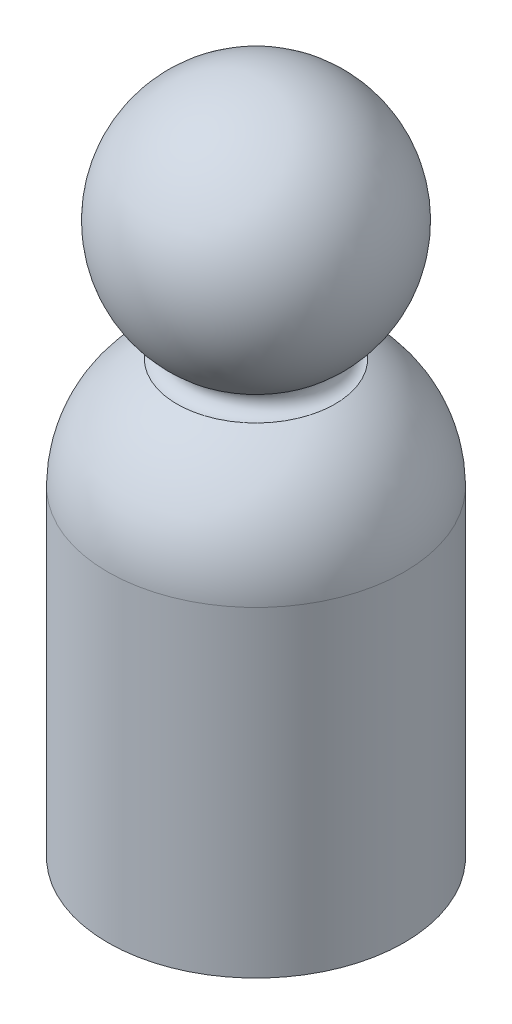
from build123d import *


with BuildPart() as part:
    # Sketch1 → Revolve1 (revolve)
    with BuildSketch(Plane.XY, mode=Mode.PRIVATE) as revolve1_sk:
        with BuildLine():
            Line((0, 0), (-12, 0))
            Line((-12, 0), (-12, 26))
            ThreePointArc((-12, 26), (-10.485281374, 31.291502622), (-6.4, 34.979977728))
            ThreePointArc((-6.4, 34.979977728), (-5.4, 35.979977728), (-6.4, 36.979977728))
            ThreePointArc((-6.4, 36.979977728), (-9.403124237, 48.066851051), (0, 54.663726813))
            Line((0, 54.663726813), (0, 0))
        make_face()
    revolve(revolve1_sk.sketch.rotate(Axis((0, 0, 0), (0, 1, 0)), 270), axis=Axis((0, 0, 0), (0, 1, 0)))


solid = part.part
